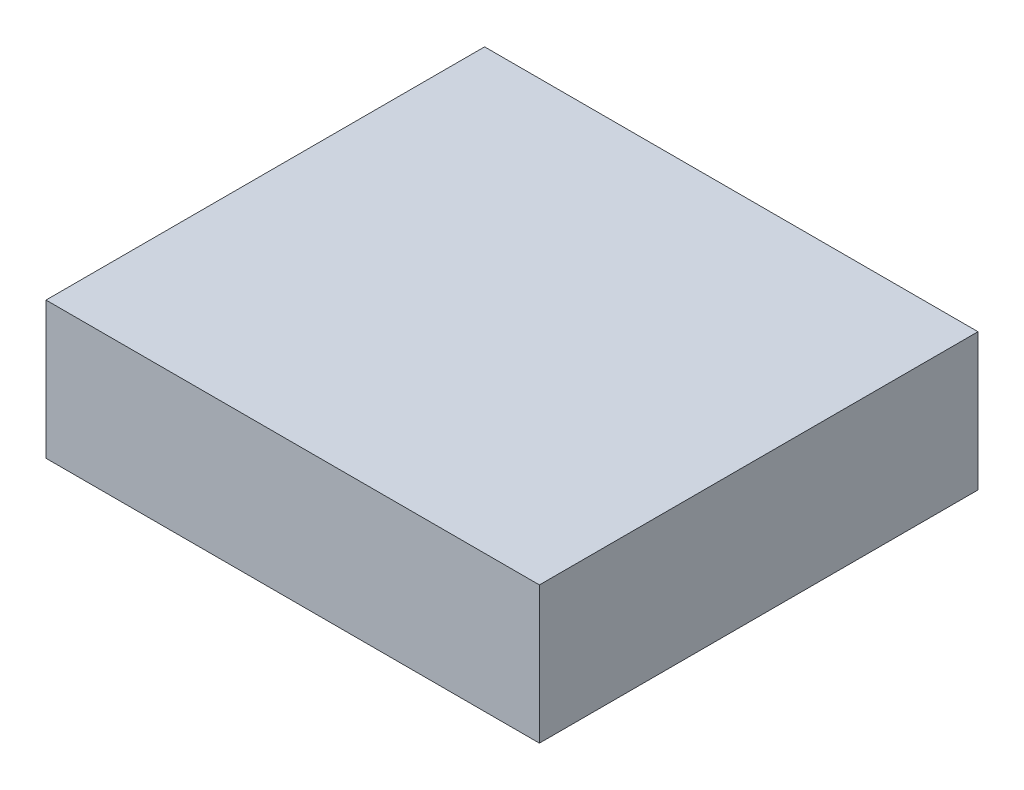
from build123d import *

# Parameters (mm, degrees)
SKETCH1_W           = 18
SKETCH1_H           = 16
BOSS_EXTRUDE1_DEPTH = 5


with BuildPart() as part:
    # Sketch1 → Boss-Extrude1 (new body)
    with BuildSketch(Plane(origin=(0, 0, 0), x_dir=(1, 0, 0), z_dir=(0, 1, 0))):
        Rectangle(SKETCH1_W, SKETCH1_H)
    extrude(amount=BOSS_EXTRUDE1_DEPTH)


solid = part.part
